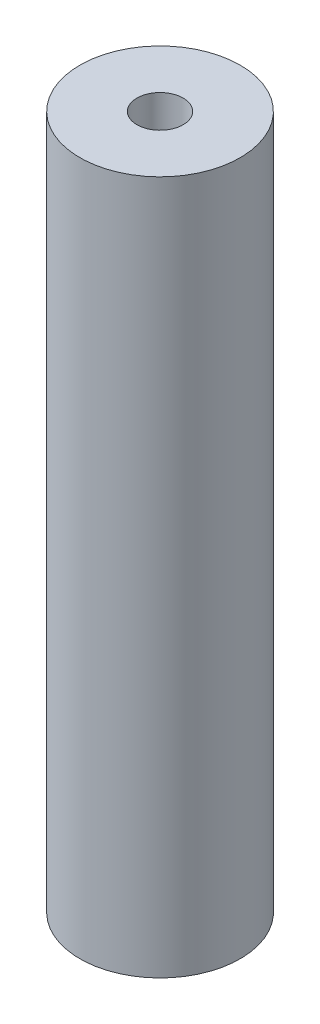
from build123d import *

# Parameters (mm, degrees)
SKETCH_1_R      = 5.2
SKETCH_1_R_2    = 3.2
EXTRUDE_1_DEPTH = 45
EXTRUDE_START   = -4
SKETCH_2_R      = 5.2
SKETCH_2_R_2    = 1.5
EXTRUDE_2_DEPTH = 4
SKETCH_3_R      = 5.2
SKETCH_3_R_2    = 1.5
EXTRUDE_3_DEPTH = 4


with BuildPart() as part:
    # Эскиз1 → Бобышка-Вытянуть1 (new body)
    with BuildSketch(Plane(origin=(0, 0, 0), x_dir=(1, 0, 0), z_dir=(0, 1, 0))):
        with Locations(Location((0, 0, 0), (0, 0, 90))):
            Circle(SKETCH_1_R)
        with Locations(Location((0, 0, 0), (0, 0, 90))):
            Circle(SKETCH_1_R_2, mode=Mode.SUBTRACT)
    extrude(amount=EXTRUDE_1_DEPTH)

    # Эскиз2 → Бобышка-Вытянуть2 (add)
    with BuildSketch(Plane(origin=(0, 45, 0), x_dir=(1, 0, 0), z_dir=(0, 1, 0)).offset(EXTRUDE_START)):
        with Locations(Location((0, 0, 0), (0, 0, 90))):
            Circle(SKETCH_2_R)
        with Locations(Location((0, 0, 0), (0, 0, 270))):
            Circle(SKETCH_2_R_2, mode=Mode.SUBTRACT)
    extrude(amount=EXTRUDE_2_DEPTH)

    # Эскиз3 → Бобышка-Вытянуть3 (add)
    with BuildSketch(Plane.XZ):
        with Locations(Location((0, 0, 0), (0, 0, 270))):
            Circle(SKETCH_3_R)
        with Locations(Location((0, 0, 0), (0, 0, 90))):
            Circle(SKETCH_3_R_2, mode=Mode.SUBTRACT)
    extrude(amount=-EXTRUDE_3_DEPTH)


solid = part.part
